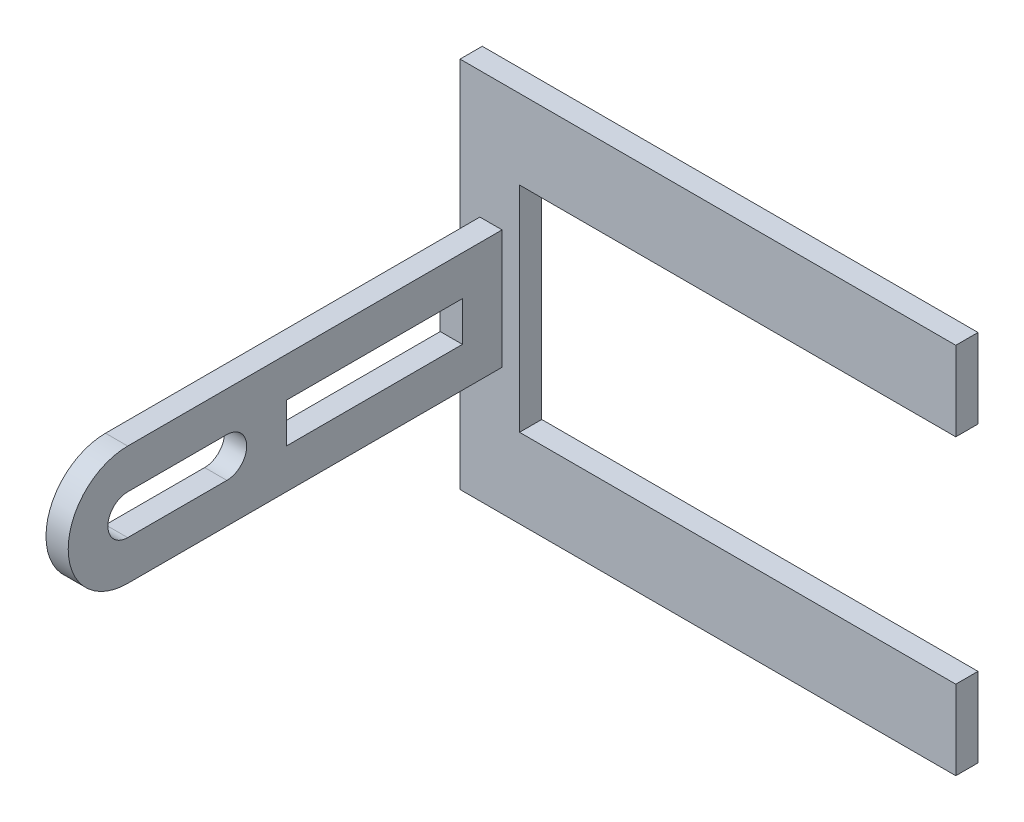
from build123d import *

# Parameters (mm, degrees)
BOSS_EXTRUDE1_DEPTH = 2.8
SKETCH2_W           = 22.2
SKETCH2_H           = 5
BOSS_EXTRUDE2_DEPTH = 2.8


with BuildPart() as part:
    # Sketch1 → Boss-Extrude1 (new body)
    with BuildSketch(Plane.XY):
        Polygon((30, 13.5), (30, 23.5), (-32.5, 23.5), (-32.5, -23.5), (30, -23.5), (30, -13.5), (-25, -13.5), (-25, 13.5), align=None)
    extrude(amount=BOSS_EXTRUDE1_DEPTH)

    # Sketch2 → Boss-Extrude2 (add)
    with BuildSketch(Plane(origin=(-30, 0, 0), x_dir=(0, 0, -1), z_dir=(1, 0, 0))):
        with BuildLine():
            Line((-2.8, -7.5), (-2.8, 7.5))
            Line((-2.8, 7.5), (-50, 7.5))
            ThreePointArc((-50, 7.5), (-57.5, 0), (-50, -7.5))
            Line((-50, -7.5), (-2.8, -7.5))
        make_face()
        with BuildLine():
            Line((-50, -2.5), (-37.5, -2.5))
            ThreePointArc((-37.5, -2.5), (-35, 0), (-37.5, 2.5))
            Line((-37.5, 2.5), (-50, 2.5))
            ThreePointArc((-50, 2.5), (-52.5, 0), (-50, -2.5))
        make_face(mode=Mode.SUBTRACT)
        with Locations((-18.9, 0)):
            Rectangle(SKETCH2_W, SKETCH2_H, mode=Mode.SUBTRACT)
    extrude(amount=BOSS_EXTRUDE2_DEPTH)


solid = part.part
